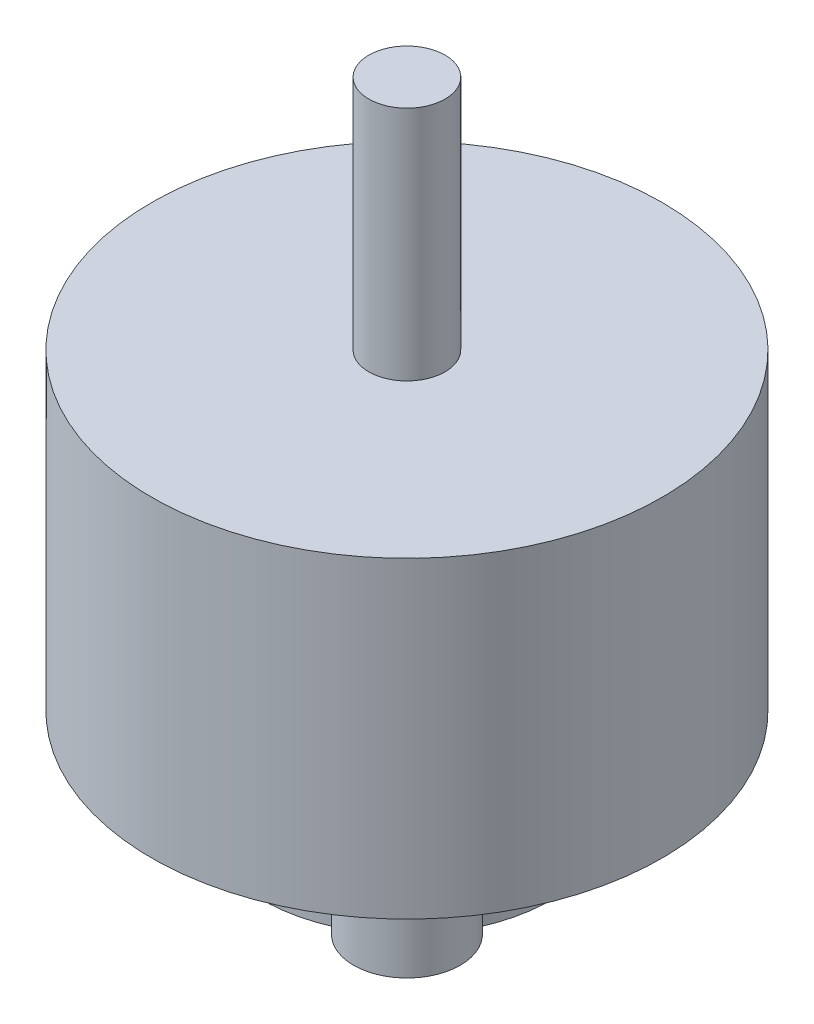
from build123d import *

# Parameters (mm, degrees)
ESQUISSE2_R          = 3.5
BOSS_EXTRU_1_DEPTH   = 3.5
D_GAGEMENT_M31_D     = 3.4
D_GAGEMENT_M31_DEPTH = 3.5


with BuildPart() as part:
    # Esquisse1 → Révolution1 (revolve)
    with BuildSketch(Plane.XY, mode=Mode.PRIVATE) as r_volution1_sk:
        Polygon((0, 0), (-9.5, 0), (-9.5, 3.5), (-7.5, 3.5), (-6.75, 6), (-16.75, 6), (-16.75, 26.5), (-2.5, 26.5), (-2.5, 42), (0, 42), align=None)
    revolve(r_volution1_sk.sketch.rotate(Axis((0, 0, 0), (0, 1, 0)), 270), axis=Axis((0, 0, 0), (0, 1, 0)))

    # Esquisse2 → Boss.-Extru.1 (add)
    with BuildSketch(Plane(origin=(0, 0, 0), x_dir=(-1, 0, 0), z_dir=(0, -1, 0))):
        with Locations((6.717514421, -6.717514421)):
            Circle(ESQUISSE2_R)
        with Locations((-6.717514421, -6.717514421)):
            Circle(ESQUISSE2_R)
        with Locations((-6.717514421, 6.717514421)):
            Circle(ESQUISSE2_R)
        with Locations((6.717514421, 6.717514421)):
            Circle(ESQUISSE2_R)
    extrude(amount=-BOSS_EXTRU_1_DEPTH)

    # Dégagement M31
    with Locations(Plane(origin=(-6.717514421, 0, 6.717514421), x_dir=(0, 0, -1), z_dir=(0, -1, 0))):
        with Locations((0, 0), (0, 13.435028842), (13.435028842, 13.435028842), (13.435028842, 0)):
            Hole(D_GAGEMENT_M31_D / 2, depth=D_GAGEMENT_M31_DEPTH)


solid = part.part
